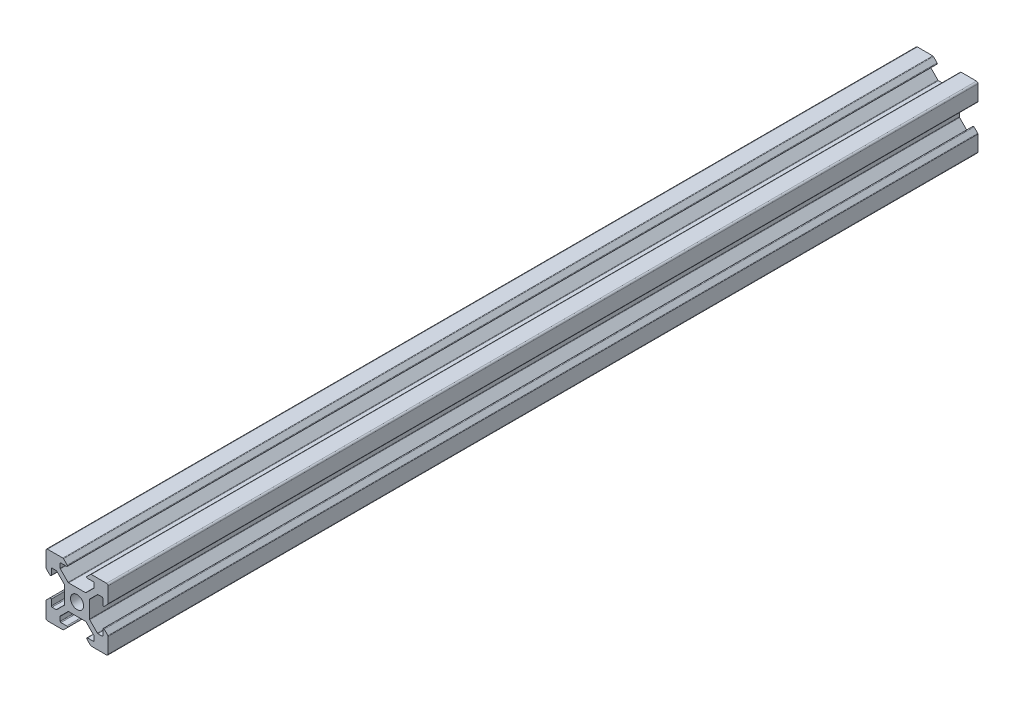
from build123d import *

# Parameters (mm, degrees)
MODEL_R             = 2.1
BOSS_EXTRUDE1_DEPTH = 280


with BuildPart() as part:
    # Model → Boss-Extrude1 (new body)
    with BuildSketch(Plane.XY):
        with BuildLine():
            Line((2012.931211125, 1381.800393717), (2012.931211125, 1378.200393717))
            Line((2012.931211125, 1378.200393717), (2012.931211125, 1377.300429431))
            ThreePointArc((2012.931211125, 1377.300429431), (2012.908374985, 1377.185624401), (2012.843343159, 1377.088297396))
            Line((2012.843343159, 1377.088297396), (2010.378662785, 1374.623617022))
            ThreePointArc((2010.378662785, 1374.623617022), (2010.297556948, 1374.569423834), (2010.20188609, 1374.550393717))
            Line((2010.20188609, 1374.550393717), (2008.881211125, 1374.550393717))
            ThreePointArc((2008.881211125, 1374.550393717), (2008.70443443, 1374.623617022), (2008.631211125, 1374.800393717))
            Line((2008.631211125, 1374.800393717), (2008.631211125, 1376.650393717))
            ThreePointArc((2008.631211125, 1376.650393717), (2008.476881983, 1376.8813636), (2008.20443443, 1376.827170412))
            Line((2008.20443443, 1376.827170412), (2007.01907909, 1375.641815073))
            ThreePointArc((2007.01907909, 1375.641815073), (2006.954047265, 1375.544488069), (2006.931211125, 1375.429683039))
            Line((2006.931211125, 1375.429683039), (2006.931211125, 1370.500393717))
            ThreePointArc((2006.931211125, 1370.500393717), (2007.077657734, 1370.146840327), (2007.431211125, 1370.000393717))
            Line((2007.431211125, 1370.000393717), (2012.360500447, 1370.000393717))
            ThreePointArc((2012.360500447, 1370.000393717), (2012.475305476, 1370.023229857), (2012.572632481, 1370.088261683))
            Line((2012.572632481, 1370.088261683), (2013.75798782, 1371.273617022))
            ThreePointArc((2013.75798782, 1371.273617022), (2013.812181008, 1371.546064575), (2013.581211125, 1371.700393717))
            Line((2013.581211125, 1371.700393717), (2011.731211125, 1371.700393717))
            ThreePointArc((2011.731211125, 1371.700393717), (2011.55443443, 1371.773617022), (2011.481211125, 1371.950393717))
            Line((2011.481211125, 1371.950393717), (2011.481211125, 1373.271068682))
            ThreePointArc((2011.481211125, 1373.271068682), (2011.500241242, 1373.36673954), (2011.55443443, 1373.447845377))
            Line((2011.55443443, 1373.447845377), (2014.033759465, 1375.927170412))
            ThreePointArc((2014.033759465, 1375.927170412), (2014.114865302, 1375.9813636), (2014.21053616, 1376.000393717))
            Line((2014.21053616, 1376.000393717), (2016.470233902, 1376.000393717))
            Line((2016.470233902, 1376.000393717), (2017.392188348, 1376.000393717))
            Line((2017.392188348, 1376.000393717), (2019.65188609, 1376.000393717))
            ThreePointArc((2019.65188609, 1376.000393717), (2019.747556948, 1375.9813636), (2019.828662785, 1375.927170412))
            Line((2019.828662785, 1375.927170412), (2022.30798782, 1373.447845377))
            ThreePointArc((2022.30798782, 1373.447845377), (2022.362181008, 1373.36673954), (2022.381211125, 1373.271068682))
            Line((2022.381211125, 1373.271068682), (2022.381211125, 1371.950393717))
            ThreePointArc((2022.381211125, 1371.950393717), (2022.30798782, 1371.773617022), (2022.131211125, 1371.700393717))
            Line((2022.131211125, 1371.700393717), (2020.281211125, 1371.700393717))
            ThreePointArc((2020.281211125, 1371.700393717), (2020.050241242, 1371.546064575), (2020.10443443, 1371.273617022))
            Line((2020.10443443, 1371.273617022), (2021.289789769, 1370.088261683))
            ThreePointArc((2021.289789769, 1370.088261683), (2021.387116773, 1370.023229857), (2021.501921803, 1370.000393717))
            Line((2021.501921803, 1370.000393717), (2026.431211125, 1370.000393717))
            ThreePointArc((2026.431211125, 1370.000393717), (2026.784764515, 1370.146840327), (2026.931211125, 1370.500393717))
            Line((2026.931211125, 1370.500393717), (2026.931211125, 1375.429683039))
            ThreePointArc((2026.931211125, 1375.429683039), (2026.908374985, 1375.544488069), (2026.843343159, 1375.641815073))
            Line((2026.843343159, 1375.641815073), (2025.65798782, 1376.827170412))
            ThreePointArc((2025.65798782, 1376.827170412), (2025.385540267, 1376.8813636), (2025.231211125, 1376.650393717))
            Line((2025.231211125, 1376.650393717), (2025.231211125, 1374.800393717))
            ThreePointArc((2025.231211125, 1374.800393717), (2025.15798782, 1374.623617022), (2024.981211125, 1374.550393717))
            Line((2024.981211125, 1374.550393717), (2023.66053616, 1374.550393717))
            ThreePointArc((2023.66053616, 1374.550393717), (2023.564865302, 1374.569423834), (2023.483759465, 1374.623617022))
            Line((2023.483759465, 1374.623617022), (2021.00443443, 1377.102942057))
            ThreePointArc((2021.00443443, 1377.102942057), (2020.950241242, 1377.184047894), (2020.931211125, 1377.279718752))
            Line((2020.931211125, 1377.279718752), (2020.931211125, 1379.539416494))
            Line((2020.931211125, 1379.539416494), (2020.931211125, 1380.46137094))
            Line((2020.931211125, 1380.46137094), (2020.931211125, 1382.721068682))
            ThreePointArc((2020.931211125, 1382.721068682), (2020.950241242, 1382.81673954), (2021.00443443, 1382.897845377))
            Line((2021.00443443, 1382.897845377), (2023.483759465, 1385.377170412))
            ThreePointArc((2023.483759465, 1385.377170412), (2023.564865302, 1385.4313636), (2023.66053616, 1385.450393717))
            Line((2023.66053616, 1385.450393717), (2024.981211125, 1385.450393717))
            ThreePointArc((2024.981211125, 1385.450393717), (2025.15798782, 1385.377170412), (2025.231211125, 1385.200393717))
            Line((2025.231211125, 1385.200393717), (2025.231211125, 1383.350393717))
            ThreePointArc((2025.231211125, 1383.350393717), (2025.385540267, 1383.119423834), (2025.65798782, 1383.173617022))
            Line((2025.65798782, 1383.173617022), (2026.843343159, 1384.358972361))
            ThreePointArc((2026.843343159, 1384.358972361), (2026.908374985, 1384.456299366), (2026.931211125, 1384.571104395))
            Line((2026.931211125, 1384.571104395), (2026.931211125, 1389.500393717))
            ThreePointArc((2026.931211125, 1389.500393717), (2026.784764516, 1389.853947108), (2026.431211125, 1390.000393717))
            Line((2026.431211125, 1390.000393717), (2021.501921803, 1390.000393717))
            ThreePointArc((2021.501921803, 1390.000393717), (2021.387116773, 1389.977557577), (2021.289789769, 1389.912525752))
            Line((2021.289789769, 1389.912525752), (2020.10443443, 1388.727170413))
            ThreePointArc((2020.10443443, 1388.727170413), (2020.050241242, 1388.454722859), (2020.281211125, 1388.300393717))
            Line((2020.281211125, 1388.300393717), (2022.131211125, 1388.300393717))
            ThreePointArc((2022.131211125, 1388.300393717), (2022.30798782, 1388.227170413), (2022.381211125, 1388.050393717))
            Line((2022.381211125, 1388.050393717), (2022.381211125, 1386.729718752))
            ThreePointArc((2022.381211125, 1386.729718752), (2022.362181008, 1386.634047894), (2022.30798782, 1386.552942057))
            Line((2022.30798782, 1386.552942057), (2019.828662785, 1384.073617022))
            ThreePointArc((2019.828662785, 1384.073617022), (2019.747556948, 1384.019423834), (2019.65188609, 1384.000393717))
            Line((2019.65188609, 1384.000393717), (2017.392188348, 1384.000393717))
            Line((2017.392188348, 1384.000393717), (2016.470233902, 1384.000393717))
            Line((2016.470233902, 1384.000393717), (2014.21053616, 1384.000393717))
            ThreePointArc((2014.21053616, 1384.000393717), (2014.114865302, 1384.019423834), (2014.033759465, 1384.073617022))
            Line((2014.033759465, 1384.073617022), (2011.55443443, 1386.552942057))
            ThreePointArc((2011.55443443, 1386.552942057), (2011.500241242, 1386.634047894), (2011.481211125, 1386.729718752))
            Line((2011.481211125, 1386.729718752), (2011.481211125, 1388.050393717))
            ThreePointArc((2011.481211125, 1388.050393717), (2011.55443443, 1388.227170413), (2011.731211125, 1388.300393717))
            Line((2011.731211125, 1388.300393717), (2013.581211125, 1388.300393717))
            ThreePointArc((2013.581211125, 1388.300393717), (2013.812181008, 1388.454722859), (2013.75798782, 1388.727170413))
            Line((2013.75798782, 1388.727170413), (2012.572632481, 1389.912525752))
            ThreePointArc((2012.572632481, 1389.912525752), (2012.475305477, 1389.977557577), (2012.360500447, 1390.000393717))
            Line((2012.360500447, 1390.000393717), (2007.431211125, 1390.000393717))
            ThreePointArc((2007.431211125, 1390.000393717), (2007.077657734, 1389.853947108), (2006.931211125, 1389.500393717))
            Line((2006.931211125, 1389.500393717), (2006.931211125, 1384.571104395))
            ThreePointArc((2006.931211125, 1384.571104395), (2006.954047265, 1384.456299366), (2007.019079091, 1384.358972361))
            Line((2007.019079091, 1384.358972361), (2008.20443443, 1383.173617022))
            ThreePointArc((2008.20443443, 1383.173617022), (2008.476881983, 1383.119423834), (2008.631211125, 1383.350393717))
            Line((2008.631211125, 1383.350393717), (2008.631211125, 1385.200393717))
            ThreePointArc((2008.631211125, 1385.200393717), (2008.70443443, 1385.377170412), (2008.881211125, 1385.450393717))
            Line((2008.881211125, 1385.450393717), (2010.20188609, 1385.450393717))
            ThreePointArc((2010.20188609, 1385.450393717), (2010.297556948, 1385.4313636), (2010.378662785, 1385.377170412))
            Line((2010.378662785, 1385.377170412), (2012.843343159, 1382.912490038))
            ThreePointArc((2012.843343159, 1382.912490038), (2012.908374985, 1382.815163033), (2012.931211125, 1382.700358004))
            Line((2012.931211125, 1382.700358004), (2012.931211125, 1381.800393717))
        make_face()
        with Locations((2016.931211125, 1380.000393717)):
            Circle(MODEL_R, mode=Mode.SUBTRACT)
    extrude(amount=BOSS_EXTRUDE1_DEPTH)


solid = part.part
